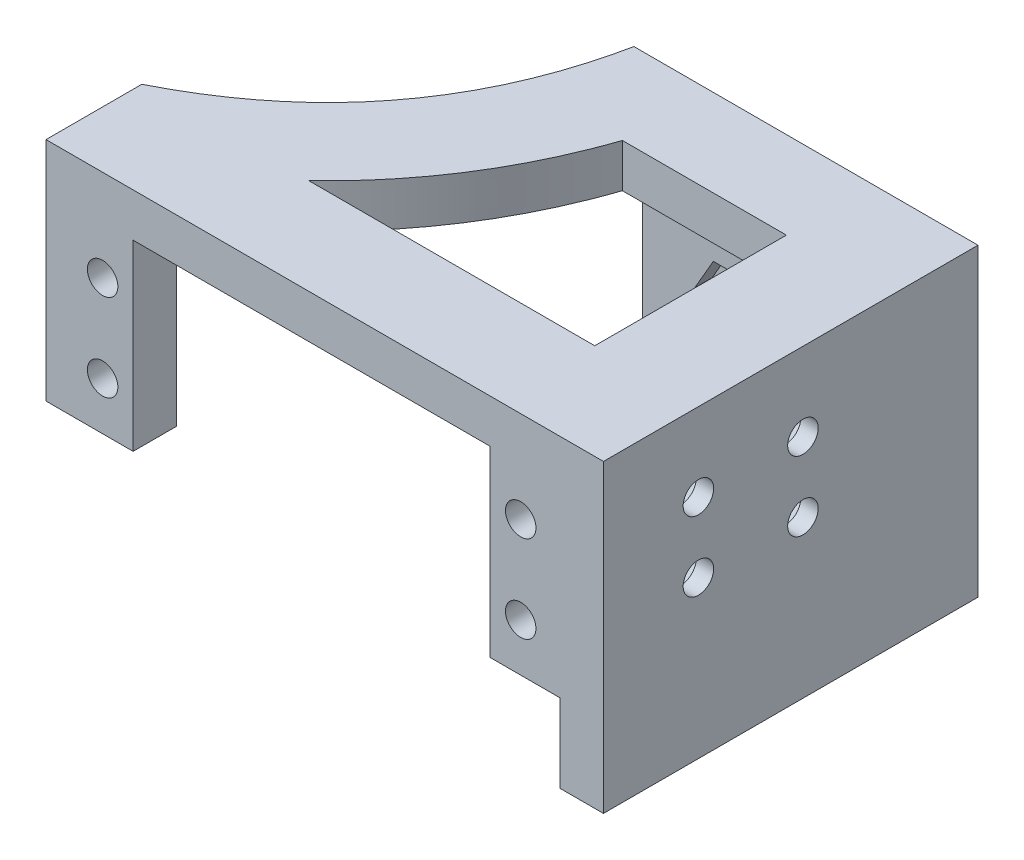
from build123d import *

# Parameters (mm, degrees)
SKETCH1_W                = 10
SKETCH1_H                = 5
BOSS_EXTRUDE1_DEPTH      = 21
BOSS_EXTRUDE1_2_DEPTH    = 21
SKETCH2_W                = 61
SKETCH2_H                = 43
BOSS_EXTRUDE2_DEPTH      = 5
SKETCH3_W                = 30.5
SKETCH3_H                = 5
BOSS_EXTRUDE3_DEPTH      = 21
CUT_EXTRUDE1_REACH       = 74.498
SKETCH4_R                = 2.2
CUT_EXTRUDE2_REACH       = 77.24
SKETCH5_R                = 1.75
CUT_EXTRUDE4_REACH       = 74.231
BOSS_EXTRUDE4_DEPTH      = 3
BOSS_EXTRUDE4_DEPTH_BACK = 2
SKETCH10_W               = 43
SKETCH10_H               = 35
CUT_EXTRUDE5_DEPTH       = 2
CUT_EXTRUDE6_REACH       = 82.077
SKETCH12_R               = 1.75
CUT_EXTRUDE7_DEPTH       = 3


with BuildPart() as part:
    # Sketch1 → Boss-Extrude1 (new body)
    with BuildSketch(Plane(origin=(0, 0, 0), x_dir=(1, 0, 0), z_dir=(0, 1, 0))):
        Rectangle(SKETCH1_W, SKETCH1_H)
    extrude(amount=BOSS_EXTRUDE1_DEPTH)



with BuildPart() as body_2:
    # Sketch1 → Boss-Extrude1 2 (new body)
    with BuildSketch(Plane(origin=(0, 0, 0), x_dir=(1, 0, 0), z_dir=(0, 1, 0))):
        with Locations((51, 0)):
            Rectangle(SKETCH1_W, SKETCH1_H)
    extrude(amount=BOSS_EXTRUDE1_2_DEPTH)


with BuildPart() as part_1:
    add(part.part)

    add(body_2.part)  # Boss-Extrude2 merges body 2
    # Sketch2 → Boss-Extrude2 (add)
    with BuildSketch(Plane(origin=(0, 21, 0), x_dir=(1, 0, 0), z_dir=(0, 1, 0))):
        with Locations((25.5, 19)):
            Rectangle(SKETCH2_W, SKETCH2_H)
    extrude(amount=BOSS_EXTRUDE2_DEPTH)

    # Sketch3 → Boss-Extrude3 (add)
    with BuildSketch(Plane.XZ.offset(-21)):
        with Locations((40.75, -38)):
            Rectangle(SKETCH3_W, SKETCH3_H)
    extrude(amount=BOSS_EXTRUDE3_DEPTH)

    # Sketch4 → Cut-Extrude1 (cut, up to next)
    with BuildSketch(Plane.XY.offset(-35.5), mode=Mode.PRIVATE) as cut_extrude1_sk1:
        with Locations((35.75, 10.5)):
            Circle(SKETCH4_R)
    cut_extrude1_tool1 = extrude(cut_extrude1_sk1.sketch, amount=-CUT_EXTRUDE1_REACH, mode=Mode.PRIVATE) & part_1.part
    add(cut_extrude1_tool1.solids().sort_by_distance((35.75, 10.5, -35.5))[0], mode=Mode.SUBTRACT)

    # Sketch5 → Cut-Extrude2 (cut, up to next)
    with BuildSketch(Plane.XY.offset(2.5), mode=Mode.PRIVATE) as cut_extrude2_sk1:
        with Locations((1.5, 15.5)):
            Circle(SKETCH5_R)
    cut_extrude2_tool1 = extrude(cut_extrude2_sk1.sketch, amount=-CUT_EXTRUDE2_REACH, mode=Mode.PRIVATE) & part_1.part
    # Sketch5 → Cut-Extrude2 (cut, up to next)
    with BuildSketch(Plane.XY.offset(2.5), mode=Mode.PRIVATE) as cut_extrude2_sk2:
        with Locations((49.5, 15.5)):
            Circle(SKETCH5_R)
    cut_extrude2_tool2 = extrude(cut_extrude2_sk2.sketch, amount=-CUT_EXTRUDE2_REACH, mode=Mode.PRIVATE) & part_1.part
    # Sketch5 → Cut-Extrude2 (cut, up to next)
    with BuildSketch(Plane.XY.offset(2.5), mode=Mode.PRIVATE) as cut_extrude2_sk3:
        with Locations((49.5, 5.5)):
            Circle(SKETCH5_R)
    cut_extrude2_tool3 = extrude(cut_extrude2_sk3.sketch, amount=-CUT_EXTRUDE2_REACH, mode=Mode.PRIVATE) & part_1.part
    # Sketch5 → Cut-Extrude2 (cut, up to next)
    with BuildSketch(Plane.XY.offset(2.5), mode=Mode.PRIVATE) as cut_extrude2_sk4:
        with Locations((1.5, 5.5)):
            Circle(SKETCH5_R)
    cut_extrude2_tool4 = extrude(cut_extrude2_sk4.sketch, amount=-CUT_EXTRUDE2_REACH, mode=Mode.PRIVATE) & part_1.part
    add(cut_extrude2_tool1.solids().sort_by_distance((1.5, 15.5, 2.5))[0], mode=Mode.SUBTRACT)
    add(cut_extrude2_tool2.solids().sort_by_distance((49.5, 15.5, 2.5))[0], mode=Mode.SUBTRACT)
    add(cut_extrude2_tool3.solids().sort_by_distance((49.5, 5.5, 2.5))[0], mode=Mode.SUBTRACT)
    add(cut_extrude2_tool4.solids().sort_by_distance((1.5, 5.5, 2.5))[0], mode=Mode.SUBTRACT)

    # Sketch7 → Cut-Extrude4 (cut, up to next)
    with BuildSketch(Plane.XZ.offset(-21), mode=Mode.PRIVATE) as cut_extrude4_sk1:
        with BuildLine():
            add(Edge.make_bspline(
                [(-5, -8.5), (10.13734929, -16.069431505), (16.393117595, -30.5)],
                knots=[0, 0, 0, 0.756510063, 0.756510063, 0.756510063], degree=2))
            Line((-5, -8.5), (-5, -40.5))
            Line((-5, -40.5), (19.5, -40.5))
            add(Edge.make_bspline(
                [(16.393117595, -30.5), (18.406595945, -35.144615311), (19.5, -40.5)],
                knots=[0.756510063, 0.756510063, 0.756510063, 1, 1, 1], degree=2))
        make_face()
    cut_extrude4_tool1 = extrude(cut_extrude4_sk1.sketch, amount=-CUT_EXTRUDE4_REACH, mode=Mode.PRIVATE) & part_1.part
    # Sketch7 → Cut-Extrude4 (cut, up to next)
    with BuildSketch(Plane.XZ.offset(-21), mode=Mode.PRIVATE) as cut_extrude4_sk2:
        with BuildLine():
            add(Edge.make_bspline(
                [(14.162446419, -8.5), (14.308605592, -8.637915777), (15.764925912, -10.027572407), (18.374354372, -12.814680355), (21.64995854, -17.12958205), (24.471025142, -21.768825406), (26.433850498, -25.877231684), (27.590424444, -28.831311595), (28.037332794, -30.099095454), (28.173885888, -30.5)],
                knots=[0.333258572, 0.333258572, 0.333258572, 0.333258572, 0.345023116, 0.45114151, 0.557259903, 0.663378297, 0.769496691, 0.822555887, 0.846906812, 0.846906812, 0.846906812, 0.846906812], degree=3))
            Line((28.173885888, -30.5), (47, -30.5))
            Line((47, -30.5), (47, -8.5))
            Line((47, -8.5), (46, -8.5))
            Line((46, -8.5), (14.162446419, -8.5))
        make_face()
    cut_extrude4_tool2 = extrude(cut_extrude4_sk2.sketch, amount=-CUT_EXTRUDE4_REACH, mode=Mode.PRIVATE) & part_1.part
    add(cut_extrude4_tool1.solids().sort_by_distance((4.583978, 21, -28.190426))[0], mode=Mode.SUBTRACT)
    add(cut_extrude4_tool2.solids().sort_by_distance((34.394415, 21, -18.474006))[0], mode=Mode.SUBTRACT)

    # Sketch10 → Boss-Extrude4 (add, two sides: drawn at the far end of the back side and taken through both)
    with BuildSketch(Plane(origin=(56, 0, 0), x_dir=(0, 0, -1), z_dir=(1, 0, 0)).offset(-BOSS_EXTRUDE4_DEPTH_BACK)):
        with Locations((19, 8.5)):
            Rectangle(SKETCH10_W, SKETCH10_H)
    extrude(amount=BOSS_EXTRUDE4_DEPTH + BOSS_EXTRUDE4_DEPTH_BACK)

    # Sketch11 → Cut-Extrude5 (cut)
    with BuildSketch(Plane.XY.offset(-35.5)):
        Polygon((37.886195996, 14.2), (33.613804004, 14.2), (31.477608008, 10.5), (33.613804004, 6.8), (37.886195996, 6.8), (40.022391992, 10.5), align=None)
    extrude(amount=-CUT_EXTRUDE5_DEPTH, mode=Mode.SUBTRACT)

    # Sketch12 → Cut-Extrude6 (cut, up to next)
    with BuildSketch(Plane(origin=(59, 0, 0), x_dir=(0, 0, -1), z_dir=(1, 0, 0)), mode=Mode.PRIVATE) as cut_extrude6_sk1:
        with Locations((8.4, 17)):
            Circle(SKETCH12_R)
    cut_extrude6_tool1 = extrude(cut_extrude6_sk1.sketch, amount=-CUT_EXTRUDE6_REACH, mode=Mode.PRIVATE) & part_1.part
    # Sketch12 → Cut-Extrude6 (cut, up to next)
    with BuildSketch(Plane(origin=(59, 0, 0), x_dir=(0, 0, -1), z_dir=(1, 0, 0)), mode=Mode.PRIVATE) as cut_extrude6_sk2:
        with Locations((8.4, 9)):
            Circle(SKETCH12_R)
    cut_extrude6_tool2 = extrude(cut_extrude6_sk2.sketch, amount=-CUT_EXTRUDE6_REACH, mode=Mode.PRIVATE) & part_1.part
    # Sketch12 → Cut-Extrude6 (cut, up to next)
    with BuildSketch(Plane(origin=(59, 0, 0), x_dir=(0, 0, -1), z_dir=(1, 0, 0)), mode=Mode.PRIVATE) as cut_extrude6_sk3:
        with Locations((20.4, 17)):
            Circle(SKETCH12_R)
    cut_extrude6_tool3 = extrude(cut_extrude6_sk3.sketch, amount=-CUT_EXTRUDE6_REACH, mode=Mode.PRIVATE) & part_1.part
    # Sketch12 → Cut-Extrude6 (cut, up to next)
    with BuildSketch(Plane(origin=(59, 0, 0), x_dir=(0, 0, -1), z_dir=(1, 0, 0)), mode=Mode.PRIVATE) as cut_extrude6_sk4:
        with Locations((20.4, 9)):
            Circle(SKETCH12_R)
    cut_extrude6_tool4 = extrude(cut_extrude6_sk4.sketch, amount=-CUT_EXTRUDE6_REACH, mode=Mode.PRIVATE) & part_1.part
    add(cut_extrude6_tool1.solids().sort_by_distance((59, 17, -8.4))[0], mode=Mode.SUBTRACT)
    add(cut_extrude6_tool2.solids().sort_by_distance((59, 9, -8.4))[0], mode=Mode.SUBTRACT)
    add(cut_extrude6_tool3.solids().sort_by_distance((59, 17, -20.4))[0], mode=Mode.SUBTRACT)
    add(cut_extrude6_tool4.solids().sort_by_distance((59, 9, -20.4))[0], mode=Mode.SUBTRACT)

    # Sketch13 → Cut-Extrude7 (cut)
    with BuildSketch(Plane.ZY.offset(-54)):
        Polygon((-12.095041723, 17), (-10.247520861, 13.8), (-6.552479139, 13.8), (-4.704958277, 17), (-6.552479139, 20.2), (-10.247520861, 20.2), align=None)
        Polygon((-10.247520861, 5.8), (-6.552479139, 5.8), (-4.704958277, 9), (-6.552479139, 12.2), (-10.247520861, 12.2), (-12.095041723, 9), align=None)
        Polygon((-18.552479139, 20.2), (-22.247520861, 20.2), (-24.095041723, 17), (-22.247520861, 13.8), (-18.552479139, 13.8), (-16.704958277, 17), align=None)
        Polygon((-22.247520861, 12.2), (-24.095041723, 9), (-22.247520861, 5.8), (-18.552479139, 5.8), (-16.704958277, 9), (-18.552479139, 12.2), align=None)
    extrude(amount=-CUT_EXTRUDE7_DEPTH, mode=Mode.SUBTRACT)


solid = part_1.part
